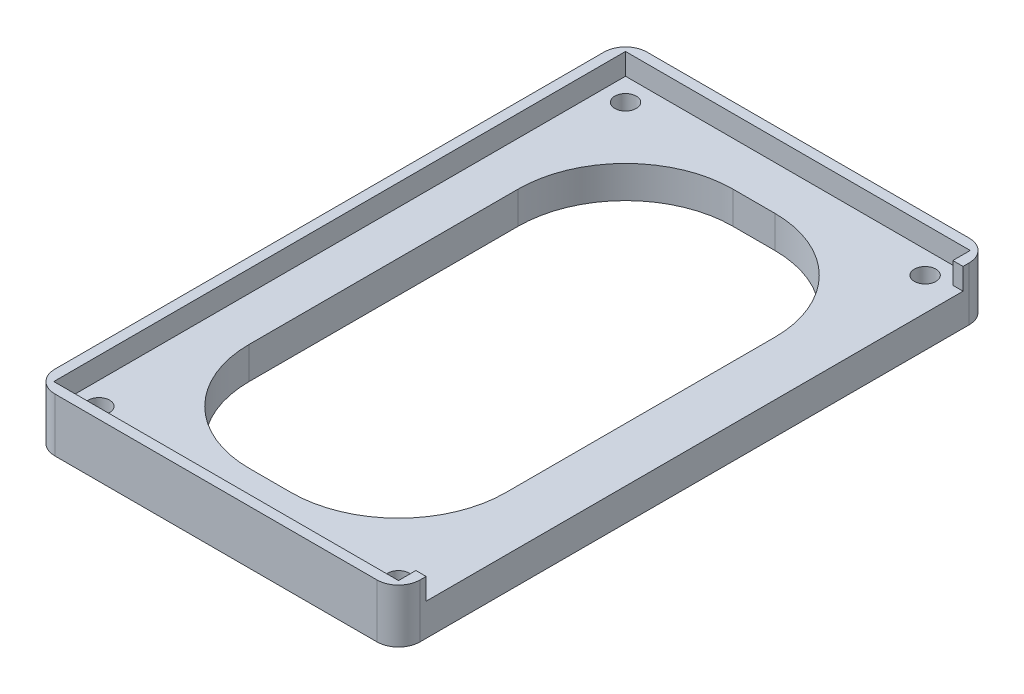
from build123d import *

# Parameters (mm, degrees)
SKETCH_1_W          = 34
SKETCH_1_H          = 55.14
EXTRUDE_1_DEPTH     = 5
SKETCH_2_W          = 32.1
SKETCH_2_H          = 53.24
CUT_EXTRUDE_1_DEPTH = 2
SKETCH_3_W          = 50
SKETCH_3_H          = 10
CUT_EXTRUDE_2_DEPTH = 2
FILLET_3_R          = 2
FILLET_4_R          = 2
FILLET_5_R          = 2
FILLET_6_R          = 2
SKETCH_5_R          = 1
CUT_EXTRUDE_3_DEPTH = 5
CUT_EXTRUDE_5_DEPTH = 5
SKETCH_7_W          = 24.577640881
SKETCH_7_H          = 46.089683544
EXTRUDE_3_DEPTH     = 3
SKETCH_8_W          = 20
SKETCH_8_H          = 6
EXTRUDE_5_DEPTH     = 5
SKETCH_9_W          = 20
SKETCH_9_H          = 6
EXTRUDE_6_DEPTH     = 5
CUT_EXTRUDE_6_DEPTH = 65.972452624
FILLET_7_R          = 2
FILLET_8_R          = 2
FILLET_9_R          = 2
FILLET_10_R         = 2
FILLET_11_R         = 2
FILLET_12_R         = 2
FILLET_13_R         = 2
FILLET_14_R         = 2
SKETCH_11_W         = 2
SKETCH_11_H         = 50
EXTRUDE_7_DEPTH     = 3
SKETCH_12_W         = 87.292454737
SKETCH_12_H         = 120.507181867
CUT_EXTRUDE_7_DEPTH = 10
SKETCH_13_W         = 23.9
SKETCH_13_H         = 45.04
CUT_EXTRUDE_8_DEPTH = 10
FILLET_15_R         = 10
FILLET_16_R         = 10
FILLET_17_R         = 10
FILLET_18_R         = 10


with BuildPart() as part:
    # 草图1 → 凸台-拉伸1 (new body)
    with BuildSketch(Plane(origin=(0, 0, 0), x_dir=(1, 0, 0), z_dir=(0, 1, 0))):
        with Locations((17, 27.57)):
            Rectangle(SKETCH_1_W, SKETCH_1_H)
    extrude(amount=EXTRUDE_1_DEPTH)

    # 草图2 → 切除-拉伸1 (cut)
    with BuildSketch(Plane(origin=(0, 5, 0), x_dir=(1, 0, 0), z_dir=(0, 1, 0))):
        with Locations((17, 27.57)):
            Rectangle(SKETCH_2_W, SKETCH_2_H)
    extrude(amount=-CUT_EXTRUDE_1_DEPTH, mode=Mode.SUBTRACT)

    # 草图3 → 切除-拉伸2 (cut)
    with BuildSketch(Plane(origin=(34, 0, 0), x_dir=(0, 0, -1), z_dir=(1, 0, 0))):
        with Locations((27.57, 5)):
            Rectangle(SKETCH_3_W, SKETCH_3_H)
    extrude(amount=-CUT_EXTRUDE_2_DEPTH, mode=Mode.SUBTRACT)

    # 圆角3
    fillet_3_edges = [part.edges().sort_by_distance(p)[0] for p in [
        (0, 2.5, 0),
    ]]
    fillet(fillet_3_edges, radius=FILLET_3_R)

    # 圆角4
    fillet_4_edges = [part.edges().sort_by_distance(p)[0] for p in [
        (0, 2.5, -55.14),
    ]]
    fillet(fillet_4_edges, radius=FILLET_4_R)

    # 圆角5
    fillet_5_edges = [part.edges().sort_by_distance(p)[0] for p in [
        (34, 2.5, -55.14),
    ]]
    fillet(fillet_5_edges, radius=FILLET_5_R)

    # 圆角6
    fillet_6_edges = [part.edges().sort_by_distance(p)[0] for p in [
        (34, 2.5, 0),
    ]]
    fillet(fillet_6_edges, radius=FILLET_6_R)

    # 草图5 → 切除-拉伸3 (cut)
    with BuildSketch(Plane(origin=(0, 3, 0), x_dir=(1, 0, 0), z_dir=(0, 1, 0))):
        with Locations(Location((3.05, 52.09, 0), (0, 0, 270))):
            Circle(SKETCH_5_R)
        with Locations(Location((3.05, 3.05, 0), (0, 0, 90))):
            Circle(SKETCH_5_R)
        with Locations(Location((30.95, 3.05, 0), (0, 0, 270))):
            Circle(SKETCH_5_R)
        with Locations(Location((30.95, 52.09, 0), (0, 0, 90))):
            Circle(SKETCH_5_R)
    extrude(amount=-CUT_EXTRUDE_3_DEPTH, mode=Mode.SUBTRACT)

    # 草图6 → 切除-拉伸5 (cut)
    with BuildSketch(Plane(origin=(0, 3, 0), x_dir=(1, 0, 0), z_dir=(0, 1, 0))):
        with BuildLine():
            ThreePointArc((5.05, 49.09), (5.342893219, 49.797106781), (6.05, 50.09))
            Line((6.05, 50.09), (6.254717451, 50.09))
            ThreePointArc((6.254717451, 50.09), (6.961824232, 49.797106781), (7.254717451, 49.09))
            Line((7.254717451, 49.09), (7.254717451, 6.05))
            ThreePointArc((7.254717451, 6.05), (6.961824232, 5.342893219), (6.254717451, 5.05))
            Line((6.254717451, 5.05), (6.05, 5.05))
            ThreePointArc((6.05, 5.05), (5.342893219, 5.342893219), (5.05, 6.05))
            Line((5.05, 6.05), (5.05, 49.09))
        make_face()
        with BuildLine():
            ThreePointArc((10.05, 49.09), (10.342893219, 49.797106781), (11.05, 50.09))
            Line((11.05, 50.09), (11.254717451, 50.09))
            ThreePointArc((11.254717451, 50.09), (11.961824232, 49.797106781), (12.254717451, 49.09))
            Line((12.254717451, 49.09), (12.254717451, 6.05))
            ThreePointArc((12.254717451, 6.05), (11.961824232, 5.342893219), (11.254717451, 5.05))
            Line((11.254717451, 5.05), (11.05, 5.05))
            ThreePointArc((11.05, 5.05), (10.342893219, 5.342893219), (10.05, 6.05))
            Line((10.05, 6.05), (10.05, 49.09))
        make_face()
        with BuildLine():
            ThreePointArc((20.05, 49.09), (20.342893219, 49.797106781), (21.05, 50.09))
            Line((21.05, 50.09), (21.254717451, 50.09))
            ThreePointArc((21.254717451, 50.09), (21.961824232, 49.797106781), (22.254717451, 49.09))
            Line((22.254717451, 49.09), (22.254717451, 6.05))
            ThreePointArc((22.254717451, 6.05), (21.961824232, 5.342893219), (21.254717451, 5.05))
            Line((21.254717451, 5.05), (21.05, 5.05))
            ThreePointArc((21.05, 5.05), (20.342893219, 5.342893219), (20.05, 6.05))
            Line((20.05, 6.05), (20.05, 49.09))
        make_face()
        with BuildLine():
            ThreePointArc((26.05, 5.05), (25.342893219, 5.342893219), (25.05, 6.05))
            Line((25.05, 6.05), (25.05, 49.09))
            ThreePointArc((25.05, 49.09), (25.342893219, 49.797106781), (26.05, 50.09))
            Line((26.05, 50.09), (26.254717451, 50.09))
            ThreePointArc((26.254717451, 50.09), (26.961824232, 49.797106781), (27.254717451, 49.09))
            Line((27.254717451, 49.09), (27.254717451, 6.05))
            ThreePointArc((27.254717451, 6.05), (26.961824232, 5.342893219), (26.254717451, 5.05))
            Line((26.254717451, 5.05), (26.05, 5.05))
        make_face()
        with BuildLine():
            Line((15.05, 49.09), (15.05, 6.05))
            ThreePointArc((15.05, 6.05), (15.342893219, 5.342893219), (16.05, 5.05))
            Line((16.05, 5.05), (16.254717451, 5.05))
            ThreePointArc((16.254717451, 5.05), (16.961824232, 5.342893219), (17.254717451, 6.05))
            Line((17.254717451, 6.05), (17.254717451, 49.09))
            ThreePointArc((17.254717451, 49.09), (16.961824232, 49.797106781), (16.254717451, 50.09))
            Line((16.254717451, 50.09), (16.05, 50.09))
            ThreePointArc((16.05, 50.09), (15.342893219, 49.797106781), (15.05, 49.09))
        make_face()
    extrude(amount=-CUT_EXTRUDE_5_DEPTH, mode=Mode.SUBTRACT)

    # 草图7 → 凸台-拉伸3 (add)
    with BuildSketch(Plane.XZ):
        with Locations((15.625766317, -27.57)):
            Rectangle(SKETCH_7_W, SKETCH_7_H)
    extrude(amount=-EXTRUDE_3_DEPTH)

    # 草图8 → 凸台-拉伸5 (add)
    with BuildSketch(Plane.XZ):
        with Locations((17, -3)):
            Rectangle(SKETCH_8_W, SKETCH_8_H)
    extrude(amount=EXTRUDE_5_DEPTH)

    # 草图9 → 凸台-拉伸6 (add)
    with BuildSketch(Plane.XZ):
        with Locations((17, -52.14)):
            Rectangle(SKETCH_9_W, SKETCH_9_H)
    extrude(amount=EXTRUDE_6_DEPTH)

    # 草图10 → 切除-拉伸6 (cut, through all)
    with BuildSketch(Plane(origin=(0, 0, -55.14), x_dir=(-1, 0, 0), z_dir=(0, 0, -1))):
        with BuildLine():
            ThreePointArc((-8, -2.5), (-11.414213562, -1.085786438), (-10, -4.5))
            Line((-10, -4.5), (-10, -2.5))
            Line((-10, -2.5), (-8, -2.5))
        make_face()
        with BuildLine():
            Line((-10, -2.5), (-10, -4.5))
            ThreePointArc((-10, -4.5), (-8.585786438, -3.914213562), (-8, -2.5))
            Line((-8, -2.5), (-10, -2.5))
        make_face()
        with BuildLine():
            ThreePointArc((-26, -2.5), (-25.414213562, -3.914213562), (-24, -4.5))
            Line((-24, -4.5), (-24, -2.5))
            Line((-24, -2.5), (-26, -2.5))
        make_face()
        with BuildLine():
            Line((-24, -2.5), (-24, -4.5))
            ThreePointArc((-24, -4.5), (-22.585786438, -3.914213562), (-22, -2.5))
            ThreePointArc((-22, -2.5), (-24, -0.5), (-26, -2.5))
            Line((-26, -2.5), (-24, -2.5))
        make_face()
    extrude(amount=-CUT_EXTRUDE_6_DEPTH, mode=Mode.SUBTRACT)

    # 圆角7
    fillet_7_edges = [part.edges().sort_by_distance(p)[0] for p in [
        (7, -5, -52.14),
    ]]
    fillet(fillet_7_edges, radius=FILLET_7_R)

    # 圆角8
    fillet_8_edges = [part.edges().sort_by_distance(p)[0] for p in [
        (7, 0, -52.14),
    ]]
    fillet(fillet_8_edges, radius=FILLET_8_R)

    # 圆角9
    fillet_9_edges = [part.edges().sort_by_distance(p)[0] for p in [
        (27, -5, -52.14),
    ]]
    fillet(fillet_9_edges, radius=FILLET_9_R)

    # 圆角10
    fillet_10_edges = [part.edges().sort_by_distance(p)[0] for p in [
        (27, 0, -52.14),
    ]]
    fillet(fillet_10_edges, radius=FILLET_10_R)

    # 圆角11
    fillet_11_edges = [part.edges().sort_by_distance(p)[0] for p in [
        (7, -5, -3),
    ]]
    fillet(fillet_11_edges, radius=FILLET_11_R)

    # 圆角12
    fillet_12_edges = [part.edges().sort_by_distance(p)[0] for p in [
        (7, 0, -3),
    ]]
    fillet(fillet_12_edges, radius=FILLET_12_R)

    # 圆角13
    fillet_13_edges = [part.edges().sort_by_distance(p)[0] for p in [
        (27, -5, -3),
    ]]
    fillet(fillet_13_edges, radius=FILLET_13_R)

    # 圆角14
    fillet_14_edges = [part.edges().sort_by_distance(p)[0] for p in [
        (27, 0, -3),
    ]]
    fillet(fillet_14_edges, radius=FILLET_14_R)

    # 草图11 → 凸台-拉伸7 (add)
    with BuildSketch(Plane.XZ):
        with Locations((33, -27.57)):
            Rectangle(SKETCH_11_W, SKETCH_11_H)
    extrude(amount=-EXTRUDE_7_DEPTH)

    # 草图12 → 切除-拉伸7 (cut)
    with BuildSketch(Plane.XZ):
        with Locations((-3.68135744, 1.129600161)):
            Rectangle(SKETCH_12_W, SKETCH_12_H)
    extrude(amount=CUT_EXTRUDE_7_DEPTH, mode=Mode.SUBTRACT)

    # 草图13 → 切除-拉伸8 (cut)
    with BuildSketch(Plane.XZ):
        with Locations((17, -27.57)):
            Rectangle(SKETCH_13_W, SKETCH_13_H)
    extrude(amount=-CUT_EXTRUDE_8_DEPTH, mode=Mode.SUBTRACT)

    # 圆角15
    fillet_15_edges = [part.edges().sort_by_distance(p)[0] for p in [
        (28.95, 1.5, -50.09),
    ]]
    fillet(fillet_15_edges, radius=FILLET_15_R)

    # 圆角16
    fillet_16_edges = [part.edges().sort_by_distance(p)[0] for p in [
        (5.05, 1.5, -50.09),
    ]]
    fillet(fillet_16_edges, radius=FILLET_16_R)

    # 圆角17
    fillet_17_edges = [part.edges().sort_by_distance(p)[0] for p in [
        (28.95, 1.5, -5.05),
    ]]
    fillet(fillet_17_edges, radius=FILLET_17_R)

    # 圆角18
    fillet_18_edges = [part.edges().sort_by_distance(p)[0] for p in [
        (5.05, 1.5, -5.05),
    ]]
    fillet(fillet_18_edges, radius=FILLET_18_R)


solid = part.part
